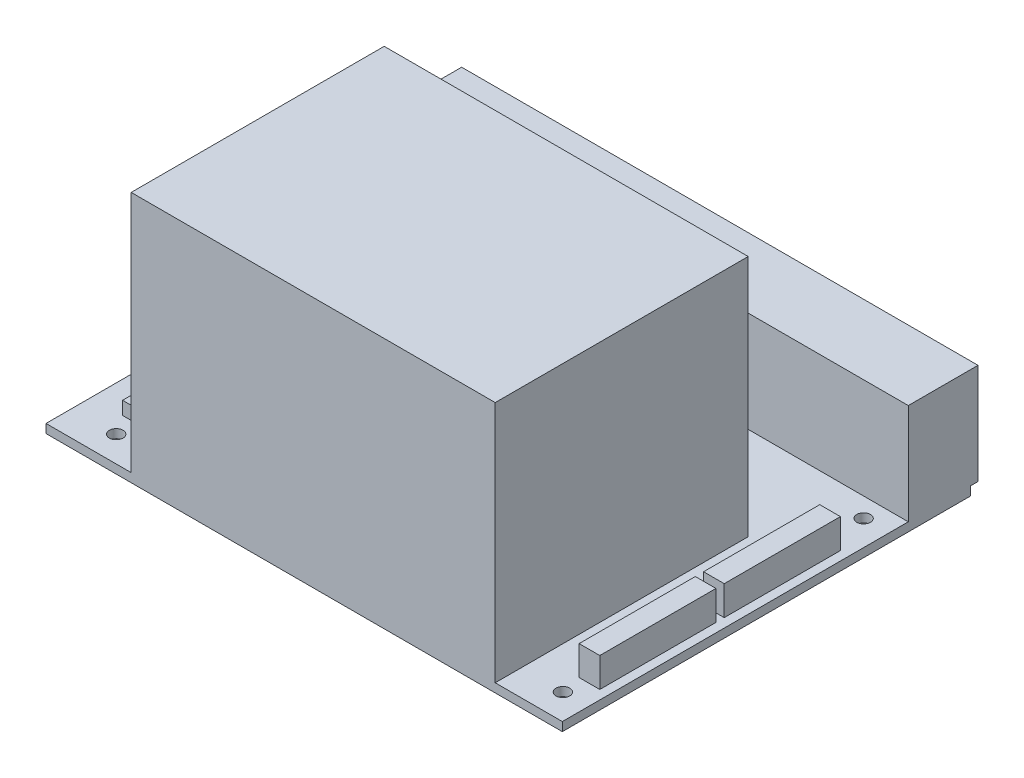
from build123d import *

# Parameters (mm, degrees)
SKETCH1_W           = 100
SKETCH1_H           = 79
SKETCH1_R           = 1.325
BOSS_EXTRUDE1_DEPTH = 1.7
SKETCH2_W           = 100
SKETCH2_H           = 19.5
BOSS_EXTRUDE2_DEPTH = 1.5
SKETCH2_2_W         = 100
SKETCH2_2_H         = 19.5
BOSS_EXTRUDE3_DEPTH = 12
SKETCH3_W           = 70.5
SKETCH3_H           = 49
BOSS_EXTRUDE4_DEPTH = 47
SKETCH4_W           = 5.05
SKETCH4_H           = 50.75
BOSS_EXTRUDE5_DEPTH = 2.55
SKETCH5_W           = 0.64
SKETCH5_H           = 0.64
BOSS_EXTRUDE6_DEPTH = 4.5
SKETCH6_W           = 4
SKETCH6_H           = 22.5
BOSS_EXTRUDE7_DEPTH = 5.7


with BuildPart() as part:
    # Sketch1 → Boss-Extrude1 (new body)
    with BuildSketch(Plane(origin=(0, 0, 0), x_dir=(1, 0, 0), z_dir=(0, 1, 0))):
        Rectangle(SKETCH1_W, SKETCH1_H)
        with Locations((-41.4, 23.75)):
            Circle(SKETCH1_R, mode=Mode.SUBTRACT)
        with Locations((-41.4, -34.5)):
            Circle(SKETCH1_R, mode=Mode.SUBTRACT)
        with Locations((45.1, 23.75)):
            Circle(SKETCH1_R, mode=Mode.SUBTRACT)
        with Locations((45.1, -34.5)):
            Circle(SKETCH1_R, mode=Mode.SUBTRACT)
    extrude(amount=BOSS_EXTRUDE1_DEPTH)



with BuildPart() as body_2:
    # Sketch2 → Boss-Extrude2 (new body)
    with BuildSketch(Plane(origin=(0, 0, -39.5), x_dir=(-1, 0, 0), z_dir=(0, 0, -1))):
        with Locations((0, 11.45)):
            Rectangle(SKETCH2_W, SKETCH2_H)
    extrude(amount=BOSS_EXTRUDE2_DEPTH)


with BuildPart() as part_1:
    add(part.part)

    add(body_2.part)  # Boss-Extrude3 merges body 2
    # Sketch2<2> → Boss-Extrude3 (add)
    with BuildSketch(Plane(origin=(0, 0, -39.5), x_dir=(-1, 0, 0), z_dir=(0, 0, -1))):
        with Locations((0, 11.45)):
            Rectangle(SKETCH2_2_W, SKETCH2_2_H)
    extrude(amount=-BOSS_EXTRUDE3_DEPTH)

    # Sketch3 → Boss-Extrude4 (add)
    with BuildSketch(Plane(origin=(0, 1.7, 0), x_dir=(1, 0, 0), z_dir=(0, 1, 0))):
        with Locations((1.75, -15)):
            Rectangle(SKETCH3_W, SKETCH3_H)
    extrude(amount=BOSS_EXTRUDE4_DEPTH)

    # Sketch4 → Boss-Extrude5 (add)
    with BuildSketch(Plane(origin=(0, 1.7, 0), x_dir=(1, 0, 0), z_dir=(0, 1, 0))):
        with Locations((-41.4, -5.375)):
            Rectangle(SKETCH4_W, SKETCH4_H)
    extrude(amount=BOSS_EXTRUDE5_DEPTH)

    # Sketch5 → Boss-Extrude6 (add)
    with BuildSketch(Plane(origin=(0, 4.25, 0), x_dir=(1, 0, 0), z_dir=(0, 1, 0))):
        with Locations((-40.162225594, 18.777225594)):
            Rectangle(SKETCH5_W, SKETCH5_H)
        with Locations((-42.702225594, 18.777225594)):
            Rectangle(SKETCH5_W, SKETCH5_H)
        with Locations((-42.702225594, 16.237225594)):
            Rectangle(SKETCH5_W, SKETCH5_H)
        with Locations((-40.162225594, 16.237225594)):
            Rectangle(SKETCH5_W, SKETCH5_H)
        with Locations((-42.702225594, 13.697225594)):
            Rectangle(SKETCH5_W, SKETCH5_H)
        with Locations((-40.162225594, 13.697225594)):
            Rectangle(SKETCH5_W, SKETCH5_H)
        with Locations((-42.702225594, 11.157225594)):
            Rectangle(SKETCH5_W, SKETCH5_H)
        with Locations((-40.162225594, 11.157225594)):
            Rectangle(SKETCH5_W, SKETCH5_H)
        with Locations((-42.702225594, 8.617225594)):
            Rectangle(SKETCH5_W, SKETCH5_H)
        with Locations((-40.162225594, 8.617225594)):
            Rectangle(SKETCH5_W, SKETCH5_H)
        with Locations((-42.702225594, 6.077225594)):
            Rectangle(SKETCH5_W, SKETCH5_H)
        with Locations((-40.162225594, 6.077225594)):
            Rectangle(SKETCH5_W, SKETCH5_H)
        with Locations((-42.702225594, 3.537225594)):
            Rectangle(SKETCH5_W, SKETCH5_H)
        with Locations((-40.162225594, 3.537225594)):
            Rectangle(SKETCH5_W, SKETCH5_H)
        with Locations((-42.702225594, 0.997225594)):
            Rectangle(SKETCH5_W, SKETCH5_H)
        with Locations((-40.162225594, 0.997225594)):
            Rectangle(SKETCH5_W, SKETCH5_H)
        with Locations((-42.702225594, -1.542774406)):
            Rectangle(SKETCH5_W, SKETCH5_H)
        with Locations((-40.162225594, -1.542774406)):
            Rectangle(SKETCH5_W, SKETCH5_H)
        with Locations((-42.702225594, -4.082774406)):
            Rectangle(SKETCH5_W, SKETCH5_H)
        with Locations((-40.162225594, -4.082774406)):
            Rectangle(SKETCH5_W, SKETCH5_H)
        with Locations((-42.702225594, -6.622774406)):
            Rectangle(SKETCH5_W, SKETCH5_H)
        with Locations((-40.162225594, -6.622774406)):
            Rectangle(SKETCH5_W, SKETCH5_H)
        with Locations((-42.702225594, -9.162774406)):
            Rectangle(SKETCH5_W, SKETCH5_H)
        with Locations((-40.162225594, -9.162774406)):
            Rectangle(SKETCH5_W, SKETCH5_H)
        with Locations((-42.702225594, -11.702774406)):
            Rectangle(SKETCH5_W, SKETCH5_H)
        with Locations((-40.162225594, -11.702774406)):
            Rectangle(SKETCH5_W, SKETCH5_H)
        with Locations((-42.702225594, -14.242774406)):
            Rectangle(SKETCH5_W, SKETCH5_H)
        with Locations((-40.162225594, -14.242774406)):
            Rectangle(SKETCH5_W, SKETCH5_H)
        with Locations((-42.702225594, -16.782774406)):
            Rectangle(SKETCH5_W, SKETCH5_H)
        with Locations((-40.162225594, -16.782774406)):
            Rectangle(SKETCH5_W, SKETCH5_H)
        with Locations((-42.702225594, -19.322774406)):
            Rectangle(SKETCH5_W, SKETCH5_H)
        with Locations((-40.162225594, -19.322774406)):
            Rectangle(SKETCH5_W, SKETCH5_H)
        with Locations((-42.702225594, -21.862774406)):
            Rectangle(SKETCH5_W, SKETCH5_H)
        with Locations((-40.162225594, -21.862774406)):
            Rectangle(SKETCH5_W, SKETCH5_H)
        with Locations((-42.702225594, -24.402774406)):
            Rectangle(SKETCH5_W, SKETCH5_H)
        with Locations((-40.162225594, -24.402774406)):
            Rectangle(SKETCH5_W, SKETCH5_H)
        with Locations((-42.702225594, -26.942774406)):
            Rectangle(SKETCH5_W, SKETCH5_H)
        with Locations((-40.162225594, -26.942774406)):
            Rectangle(SKETCH5_W, SKETCH5_H)
        with Locations((-42.702225594, -29.482774406)):
            Rectangle(SKETCH5_W, SKETCH5_H)
        with Locations((-40.162225594, -29.482774406)):
            Rectangle(SKETCH5_W, SKETCH5_H)
    extrude(amount=BOSS_EXTRUDE6_DEPTH)

    # Sketch6 → Boss-Extrude7 (add)
    with BuildSketch(Plane(origin=(0, 1.7, 0), x_dir=(1, 0, 0), z_dir=(0, 1, 0))):
        with Locations((46.25, 4.85)):
            Rectangle(SKETCH6_W, SKETCH6_H)
        with Locations((46.25, -19.25)):
            Rectangle(SKETCH6_W, SKETCH6_H)
    extrude(amount=BOSS_EXTRUDE7_DEPTH)


solid = part_1.part
